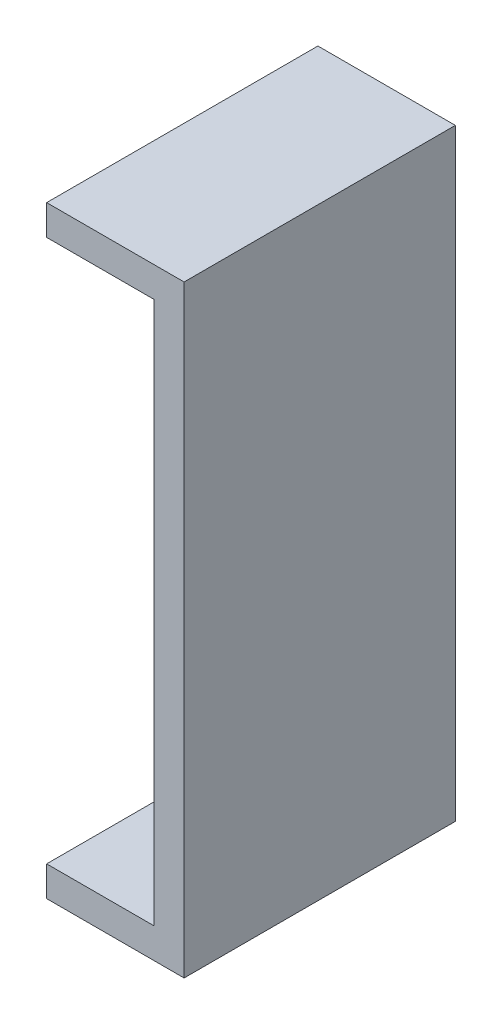
from build123d import *

# Parameters (mm, degrees)
SKETCH1_W           = 100
SKETCH1_H           = 75
BOSS_EXTRUDE1_DEPTH = 45
SKETCH2_W           = 15
SKETCH2_H           = 25
CUT_EXTRUDE1_DEPTH  = 78.014609004
SKETCH3_W           = 30.197143083
SKETCH3_H           = 100
CUT_EXTRUDE2_DEPTH  = 78.014609004


with BuildPart() as part:
    # Sketch1 → Boss-Extrude1 (new body)
    with BuildSketch(Plane(origin=(0, 0, 0), x_dir=(0, 1, 0), z_dir=(0, 0, 1))):
        Rectangle(SKETCH1_W, SKETCH1_H)
    extrude(amount=BOSS_EXTRUDE1_DEPTH)

    # Sketch2 → Cut-Extrude1 (cut, through all)
    with BuildSketch(Plane.XY.offset(45)):
        Polygon((-15.5, 18), (-32.5, 18), (-32.5, -45), (32.5, -45), (32.5, 45), (-15.5, 45), (-15.5, 20), align=None)
        with Locations((-25, 32.5)):
            Rectangle(SKETCH2_W, SKETCH2_H)
    extrude(amount=-CUT_EXTRUDE1_DEPTH, mode=Mode.SUBTRACT)

    # Sketch3 → Cut-Extrude2 (cut, through all)
    with BuildSketch(Plane.XY.offset(45)):
        with Locations((-0.401428459, 0)):
            Rectangle(SKETCH3_W, SKETCH3_H)
    extrude(amount=-CUT_EXTRUDE2_DEPTH, mode=Mode.SUBTRACT)


with BuildPart() as body_2:
    # of the pieces the cut leaves, the one that is kept (cut_extrude2_keep)
    add(part.part.solids().sort_by_distance((37.5, -50, 0))[0])


solid = body_2.part
